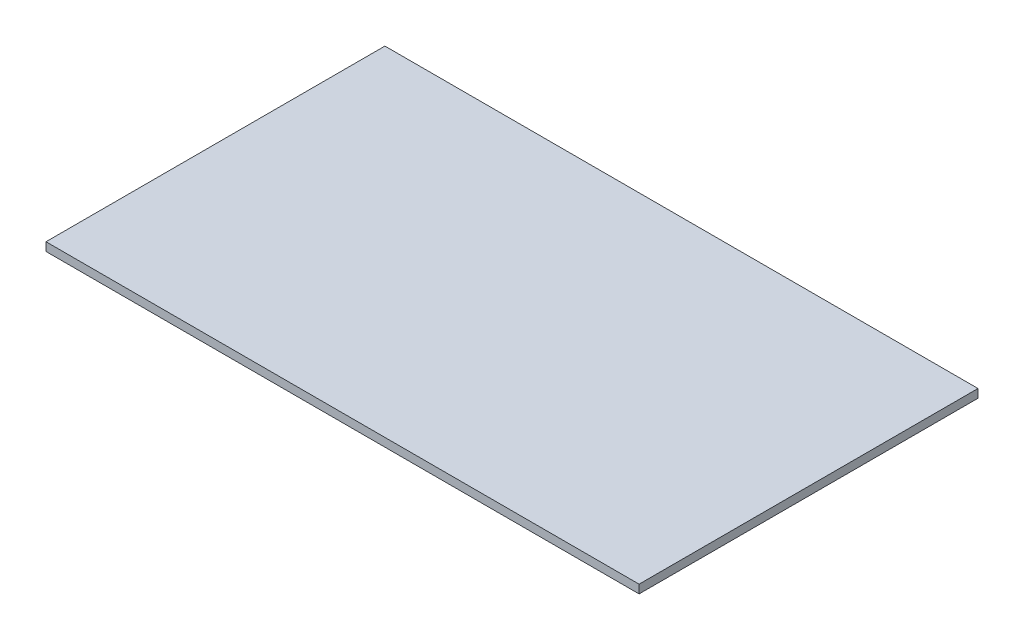
from build123d import *

# Parameters (mm, degrees)
SKETCH1_W           = 350
SKETCH1_H           = 200
BOSS_EXTRUDE1_DEPTH = 5


with BuildPart() as part:
    # Sketch1 → Boss-Extrude1 (new body)
    with BuildSketch(Plane(origin=(0, 0, 0), x_dir=(1, 0, 0), z_dir=(0, 1, 0))):
        Rectangle(SKETCH1_W, SKETCH1_H)
    extrude(amount=BOSS_EXTRUDE1_DEPTH)


solid = part.part
